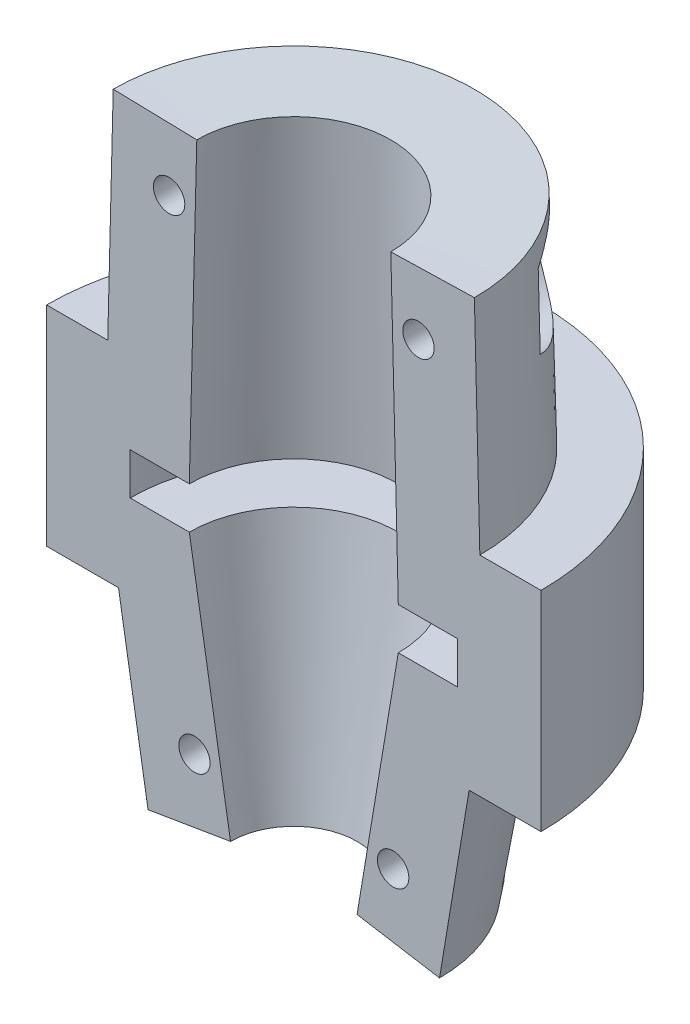
from build123d import *

# Parameters (mm, degrees)
REVOLVE1_ANGLE     = 180
SKETCH27_R         = 0.75
CUT_EXTRUDE5_DEPTH = 31.850211464
CUT_EXTRUDE6_START = -4
SKETCH27_5_R       = 2.5
SKETCH27_5_R_2     = 0.75
CUT_EXTRUDE6_DEPTH = 10


with BuildPart() as part:
    # Sketch1 → Revolve1 (revolve)
    with BuildSketch(Plane.XY):
        Polygon((6.973429247, -3.10464929), (8.388508538, 5.385826457), (11.829278376, 5.385826457), (11.829278376, 15.385826457), (8.901993981, 15.385826457), (8.640637377, 25.920491769), (4.641867801, 25.8212855), (4.999999973, 11.385826457), (7.829278376, 11.385826457), (7.829278376, 9.385826457), (5.000000185, 9.385826457), (3.027853552, -2.447053341), align=None)
    revolve(axis=Axis((0, 0, 0), (0, 1, 0)), revolution_arc=REVOLVE1_ANGLE)

    # Sketch27 → Cut-Extrude5 (cut, through all)
    with BuildSketch(Plane.XY):
        with Locations((5.965887995, 22.853210278)):
            Circle(SKETCH27_R)
        with Locations((-5.965887995, 22.853210278)):
            Circle(SKETCH27_R)
        with Locations((4.754042918, 0.306629697)):
            Circle(SKETCH27_R)
        with Locations((-4.754042918, 0.306629697)):
            Circle(SKETCH27_R)
    extrude(amount=-CUT_EXTRUDE5_DEPTH, mode=Mode.SUBTRACT)

    # Sketch27<5> → Cut-Extrude6 (cut)
    # profile 1 of 4: a face of its own
    with BuildSketch(Plane.XY.offset(CUT_EXTRUDE6_START)):
        with Locations((5.965887995, 22.853210278)):
            Circle(SKETCH27_5_R)
        with Locations((5.965887995, 22.853210278)):
            Circle(SKETCH27_5_R_2, mode=Mode.SUBTRACT)
    # profile 2 of 4: a face of its own
    with BuildSketch(Plane.XY.offset(CUT_EXTRUDE6_START)):
        with Locations((-5.965887995, 22.853210278)):
            Circle(SKETCH27_5_R)
        with Locations((-5.965887995, 22.853210278)):
            Circle(SKETCH27_5_R_2, mode=Mode.SUBTRACT)
    # profile 3 of 4: a face of its own
    with BuildSketch(Plane.XY.offset(CUT_EXTRUDE6_START)):
        with Locations((4.754042918, 0.306629697)):
            Circle(SKETCH27_5_R)
        with Locations((4.754042918, 0.306629697)):
            Circle(SKETCH27_5_R_2, mode=Mode.SUBTRACT)
    # profile 4 of 4: a face of its own
    with BuildSketch(Plane.XY.offset(CUT_EXTRUDE6_START)):
        with Locations((-4.754042918, 0.306629697)):
            Circle(SKETCH27_5_R)
        with Locations((-4.754042918, 0.306629697)):
            Circle(SKETCH27_5_R_2, mode=Mode.SUBTRACT)
    extrude(amount=-CUT_EXTRUDE6_DEPTH, mode=Mode.SUBTRACT)


solid = part.part
